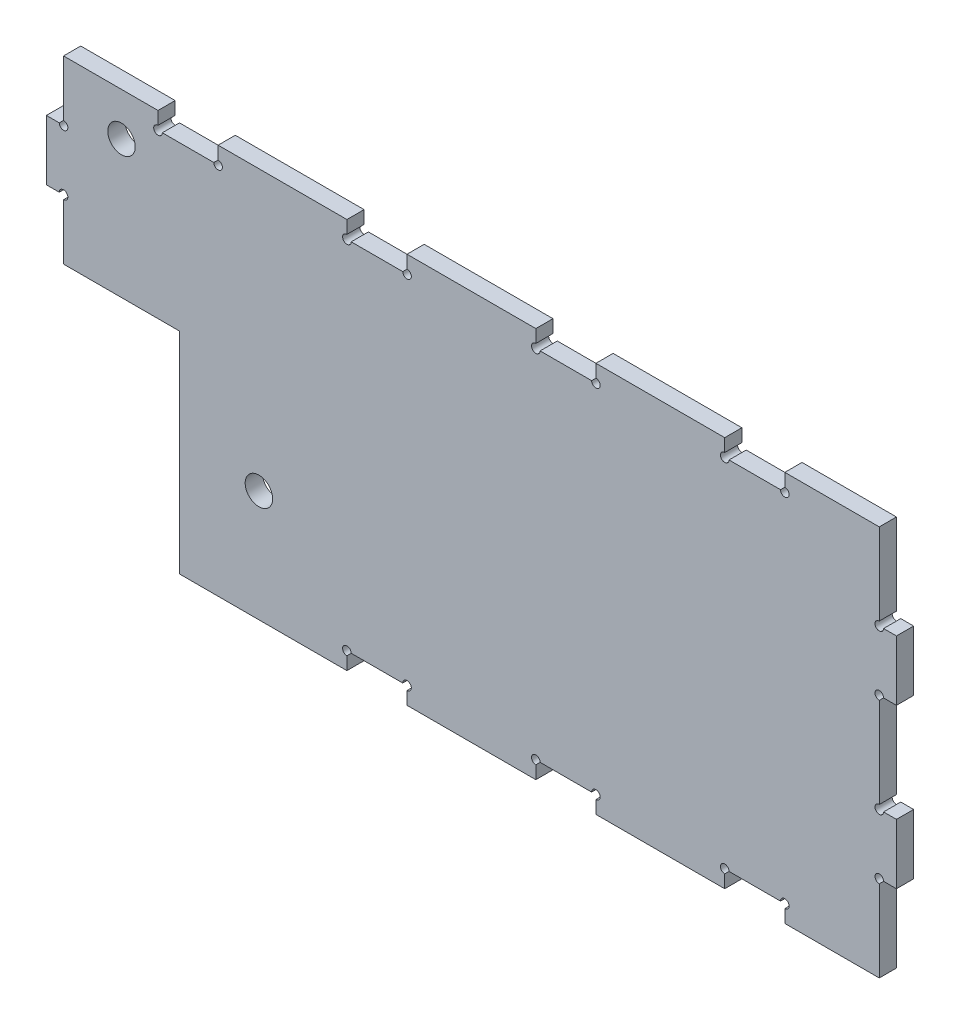
from build123d import *

# Parameters (mm, degrees)
SKETCH_1_W          = 95
SKETCH_1_H          = 45.5
EXTRUDE_1_DEPTH     = 2
SKETCH_2_W          = 7
SKETCH_2_H          = 2
CUT_EXTRUDE_1_DEPTH = 106.352978126
SKETCH_3_R          = 0.5
CUT_EXTRUDE_2_DEPTH = 106.352978126
SKETCH_5_W          = 13.5
SKETCH_5_H          = 24.5
CUT_EXTRUDE_3_DEPTH = 106.352978126
SKETCH_6_W          = 2
SKETCH_6_H          = 7
EXTRUDE_2_DEPTH     = 2
SKETCH_7_R          = 1.6
CUT_EXTRUDE_4_DEPTH = 2


with BuildPart() as part:
    # 草图1 → 凸台-拉伸1 (new body)
    with BuildSketch(Plane.XY):
        with Locations((47.5, 22.75)):
            Rectangle(SKETCH_1_W, SKETCH_1_H)
    extrude(amount=EXTRUDE_1_DEPTH)

    # 草图2 → 切除-拉伸1 (cut, through all)
    with BuildSketch(Plane.XY.offset(2)):
        with Locations((58.5, 44.5)):
            Rectangle(SKETCH_2_W, SKETCH_2_H)
        with Locations((36.5, 44.5)):
            Rectangle(SKETCH_2_W, SKETCH_2_H)
        with Locations((14.5, 44.5)):
            Rectangle(SKETCH_2_W, SKETCH_2_H)
        with Locations((80.5, 44.5)):
            Rectangle(SKETCH_2_W, SKETCH_2_H)
        with Locations((36.5, 1)):
            Rectangle(SKETCH_2_W, SKETCH_2_H)
        with Locations((58.5, 1)):
            Rectangle(SKETCH_2_W, SKETCH_2_H)
        with Locations((80.5, 1)):
            Rectangle(SKETCH_2_W, SKETCH_2_H)
    extrude(amount=-CUT_EXTRUDE_1_DEPTH, mode=Mode.SUBTRACT)

    # 草图3 → 切除-拉伸2 (cut, through all)
    with BuildSketch(Plane.XY.offset(2)):
        with Locations((11, 43.5)):
            Circle(SKETCH_3_R)
    cut_extrude_2 = extrude(amount=-CUT_EXTRUDE_2_DEPTH, mode=Mode.SUBTRACT)

    # 草图5 → 切除-拉伸3 (cut, through all)
    with BuildSketch(Plane.XY.offset(2)):
        with Locations((6.75, 12.25)):
            Rectangle(SKETCH_5_W, SKETCH_5_H)
    extrude(amount=-CUT_EXTRUDE_3_DEPTH, mode=Mode.SUBTRACT)

    # 草图6 → 凸台-拉伸2 (add)
    with BuildSketch(Plane.XY.offset(2)):
        with Locations((-1, 35)):
            Rectangle(SKETCH_6_W, SKETCH_6_H)
        with Locations((96, 32)):
            Rectangle(SKETCH_6_W, SKETCH_6_H)
        with Locations((96, 13.5)):
            Rectangle(SKETCH_6_W, SKETCH_6_H)
    extrude(amount=-EXTRUDE_2_DEPTH)

    # 草图阵列1: 切除-拉伸2 at 19 more places
    with Locations((7, 0, 0), (22, 0, 0), (29, 0, 0), (44, 0, 0), (51, 0, 0), (66, 0, 0), (73, 0, 0), (73, -41.5, 0), (66, -41.5, 0), (51, -41.5, 0), (44, -41.5, 0), (29, -41.5, 0), (22, -41.5, 0), (-11, -12, 0), (84, -8, 0), (-11, -5, 0), (84, -15, 0), (84, -26.5, 0), (84, -33.5, 0)):
        add(cut_extrude_2, mode=Mode.SUBTRACT)

    # 草图7 → 切除-拉伸4 (cut)
    with BuildSketch(Plane.XY.offset(2)):
        with Locations((6.75, 40.5)):
            Circle(SKETCH_7_R)
        with Locations((22.75, 13)):
            Circle(SKETCH_7_R)
    extrude(amount=-CUT_EXTRUDE_4_DEPTH, mode=Mode.SUBTRACT)


solid = part.part
